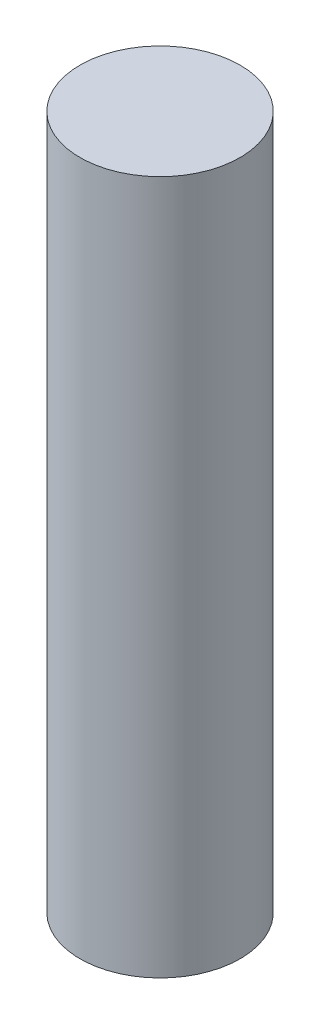
from build123d import *

# Parameters (mm, degrees)
SKETCH1_W   = 1.5
SKETCH1_H   = 11
SKETCH1_H_2 = 2


with BuildPart() as part:
    # Sketch1 → Revolve1 (revolve)
    with BuildSketch(Plane.XY, mode=Mode.PRIVATE) as revolve1_sk:
        with Locations((0.75, 5.5)):
            Rectangle(SKETCH1_W, SKETCH1_H)
        with Locations((0.75, 12)):
            Rectangle(SKETCH1_W, SKETCH1_H_2)
    revolve(revolve1_sk.sketch.rotate(Axis((0, 11, 0), (0, 1, 0)), 90), axis=Axis((0, 11, 0), (0, 1, 0)))


solid = part.part
